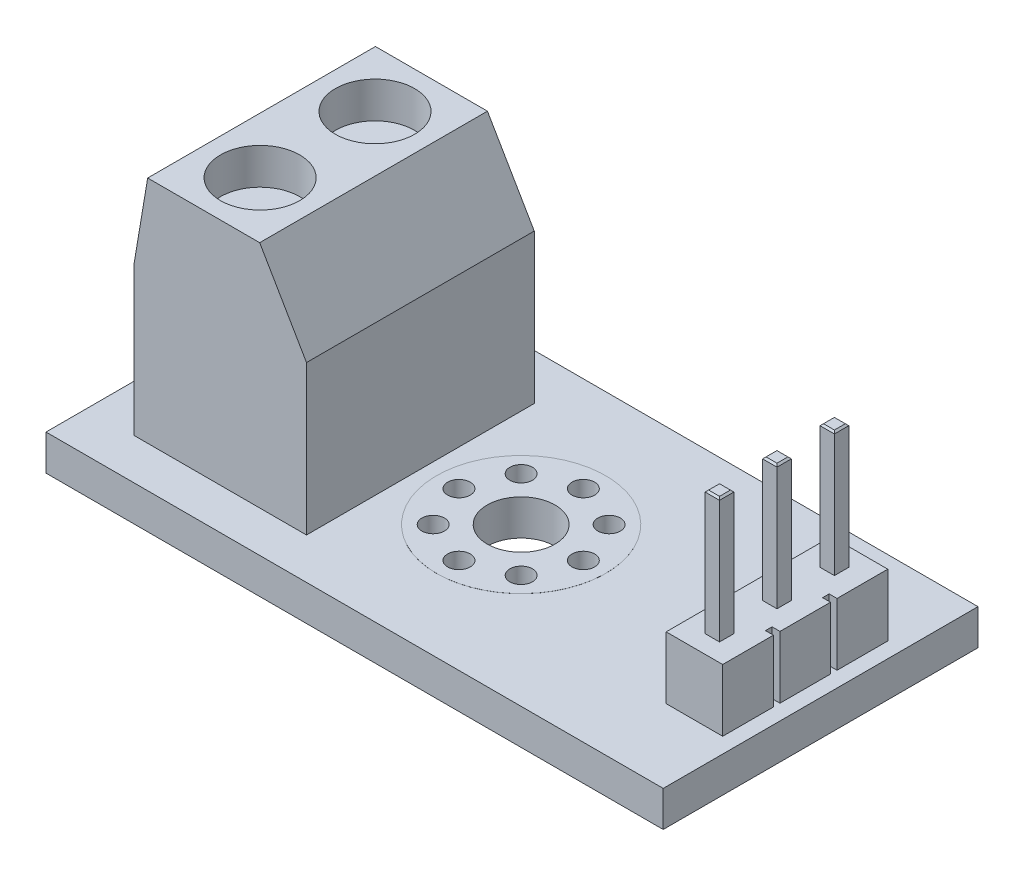
from build123d import *

# Parameters (mm, degrees)
SKETCH1_W                = 27.2923
SKETCH1_H                = 13.9192
BOSS_EXTRUDE1_DEPTH      = 0.7874
SKETCH2_R                = 1.5
SKETCH2_R_2              = 0.5
CUT_EXTRUDE1_DEPTH       = 16.399137542
SKETCH3_W                = 2.5
SKETCH3_H                = 7.3
BOSS_EXTRUDE2_DEPTH      = 2.75
SKETCH4_W                = 0.35
SKETCH4_H                = 0.29
CUT_EXTRUDE2_DEPTH       = 2.75
BOSS_EXTRUDE3_DEPTH      = 5.5
BOSS_EXTRUDE3_DEPTH_BACK = 5.7726
SKETCH5_W                = 0.635
SKETCH5_H                = 0.635
BOSS_EXTRUDE4_START      = 0.00254
SKETCH6_R                = 3.741578583
SKETCH6_R_2              = 0.5
SKETCH6_R_3              = 1.5
BOSS_EXTRUDE4_DEPTH      = 0.00254
SKETCH7_W                = 7.62
SKETCH7_H                = 10.0711
BOSS_EXTRUDE5_DEPTH      = 10.16
CUT_EXTRUDE3_DEPTH       = 19.82814406
CUT_EXTRUDE3_DEPTH_BACK  = 19.82814406
SKETCH9_R                = 1.7526
CUT_EXTRUDE4_DEPTH       = 1.6002
SKETCH10_W               = 0.635
SKETCH10_H               = 0.635
BOSS_EXTRUDE6_DEPTH      = 3.7338
CHAMFER1_SIZE            = 0.0762
SKETCH11_W               = 4.064
SKETCH11_H               = 5.08
CUT_EXTRUDE5_DEPTH       = 1.6002


with BuildPart() as part:
    # Sketch1 → Boss-Extrude1 (new, symmetric)
    with BuildSketch(Plane(origin=(0, 0, 0), x_dir=(1, 0, 0), z_dir=(0, 1, 0))):
        Rectangle(SKETCH1_W, SKETCH1_H)
    extrude(amount=BOSS_EXTRUDE1_DEPTH, both=True)

    # Sketch2 → Cut-Extrude1 (cut, through all)
    with BuildSketch(Plane(origin=(0, 0.7874, 0), x_dir=(1, 0, 0), z_dir=(0, 1, 0))):
        with Locations(Location((0.40385, 0, 0), (0, 0, 270))):
            Circle(SKETCH2_R)
        with Locations(Location((0.40385, 2.75, 0), (0, 0, 270))):
            Circle(SKETCH2_R_2)
        with Locations(Location((2.348393648, 1.944543648, 0), (0, 0, 270))):
            Circle(SKETCH2_R_2)
        with Locations(Location((3.15385, 0, 0), (0, 0, 270))):
            Circle(SKETCH2_R_2)
        with Locations(Location((2.348393648, -1.944543648, 0), (0, 0, 270))):
            Circle(SKETCH2_R_2)
        with Locations(Location((0.40385, -2.75, 0), (0, 0, 270))):
            Circle(SKETCH2_R_2)
        with Locations(Location((-1.540693648, -1.944543648, 0), (0, 0, 270))):
            Circle(SKETCH2_R_2)
        with Locations(Location((-2.34615, 0, 0), (0, 0, 270))):
            Circle(SKETCH2_R_2)
        with Locations(Location((-1.540693648, 1.944543648, 0), (0, 0, 270))):
            Circle(SKETCH2_R_2)
    extrude(amount=-CUT_EXTRUDE1_DEPTH, mode=Mode.SUBTRACT)

    # Sketch3 → Boss-Extrude2 (add)
    with BuildSketch(Plane(origin=(0, 0.7874, 0), x_dir=(1, 0, 0), z_dir=(0, 1, 0))):
        with Locations((11.71615, 0)):
            Rectangle(SKETCH3_W, SKETCH3_H)
    extrude(amount=BOSS_EXTRUDE2_DEPTH)

    # Sketch4 → Cut-Extrude2 (cut)
    with BuildSketch(Plane(origin=(0, 3.5374, 0), x_dir=(1, 0, 0), z_dir=(0, 1, 0))):
        with Locations((10.64115, 1.261418)):
            Rectangle(SKETCH4_W, SKETCH4_H)
        with Locations((10.64115, -1.261418)):
            Rectangle(SKETCH4_W, SKETCH4_H)
        with Locations((12.79115, -1.261418)):
            Rectangle(SKETCH4_W, SKETCH4_H)
        with Locations((12.79115, 1.261418)):
            Rectangle(SKETCH4_W, SKETCH4_H)
    extrude(amount=-CUT_EXTRUDE2_DEPTH, mode=Mode.SUBTRACT)

    # Sketch5 → Boss-Extrude3 (add, two sides: drawn at the far end of the back side and taken through both)
    with BuildSketch(Plane(origin=(0, 3.5374, 0), x_dir=(1, 0, 0), z_dir=(0, 1, 0)).offset(-BOSS_EXTRUDE3_DEPTH_BACK)):
        with Locations((11.71615, 0)):
            Rectangle(SKETCH5_W, SKETCH5_H)
        with Locations((11.71615, 2.54)):
            Rectangle(SKETCH5_W, SKETCH5_H)
        with Locations((11.71615, -2.54)):
            Rectangle(SKETCH5_W, SKETCH5_H)
    extrude(amount=BOSS_EXTRUDE3_DEPTH + BOSS_EXTRUDE3_DEPTH_BACK)

    # Sketch6 → Boss-Extrude4 (add)
    with BuildSketch(Plane(origin=(0, 0.7874, 0), x_dir=(1, 0, 0), z_dir=(0, 1, 0)).offset(BOSS_EXTRUDE4_START)):
        with Locations(Location((0.40385, 0, 0), (0, 0, 270))):
            Circle(SKETCH6_R)
        with Locations(Location((-2.34615, 0, 0), (0, 0, 270))):
            Circle(SKETCH6_R_2, mode=Mode.SUBTRACT)
        with Locations(Location((-1.540693648, -1.944543648, 0), (0, 0, 270))):
            Circle(SKETCH6_R_2, mode=Mode.SUBTRACT)
        with Locations(Location((0.40385, -2.75, 0), (0, 0, 270))):
            Circle(SKETCH6_R_2, mode=Mode.SUBTRACT)
        with Locations(Location((2.348393648, -1.944543648, 0), (0, 0, 270))):
            Circle(SKETCH6_R_2, mode=Mode.SUBTRACT)
        with Locations(Location((3.15385, 0, 0), (0, 0, 270))):
            Circle(SKETCH6_R_2, mode=Mode.SUBTRACT)
        with Locations(Location((2.348393648, 1.944543648, 0), (0, 0, 270))):
            Circle(SKETCH6_R_2, mode=Mode.SUBTRACT)
        with Locations(Location((0.40385, 0, 0), (0, 0, 270))):
            Circle(SKETCH6_R_3, mode=Mode.SUBTRACT)
        with Locations(Location((-1.540693648, 1.944543648, 0), (0, 0, 270))):
            Circle(SKETCH6_R_2, mode=Mode.SUBTRACT)
        with Locations(Location((0.40385, 2.75, 0), (0, 0, 270))):
            Circle(SKETCH6_R_2, mode=Mode.SUBTRACT)
    boss_extrude4 = extrude(amount=-BOSS_EXTRUDE4_DEPTH)

    # Mirror1: Boss-Extrude4 across plane
    add(boss_extrude4.mirror(Plane.ZX))

    # Sketch7 → Boss-Extrude5 (add)
    with BuildSketch(Plane(origin=(0, 0.7874, 0), x_dir=(1, 0, 0), z_dir=(0, 1, 0))):
        with Locations((-7.75335, -0.10795)):
            Rectangle(SKETCH7_W, SKETCH7_H)
    extrude(amount=BOSS_EXTRUDE5_DEPTH)

    # Sketch8 → Cut-Extrude3 (cut, two sides: drawn at the far end of the back side and taken through both)
    with BuildSketch(Plane.XY.offset(-CUT_EXTRUDE3_DEPTH_BACK)):
        Polygon((-6.01345, 10.9474), (-3.94335, 7.3914), (-3.94335, 10.9474), align=None)
        Polygon((-10.96645, 10.9474), (-11.56335, 10.9474), (-11.56335, 7.3914), align=None)
    extrude(amount=CUT_EXTRUDE3_DEPTH + CUT_EXTRUDE3_DEPTH_BACK, mode=Mode.SUBTRACT)

    # Sketch9 → Cut-Extrude4 (cut)
    with BuildSketch(Plane(origin=(0, 10.9474, 0), x_dir=(1, 0, 0), z_dir=(0, 1, 0))):
        with Locations(Location((-8.48995, 2.43205, 0), (0, 0, 270))):
            Circle(SKETCH9_R)
        with Locations(Location((-8.48995, -2.64795, 0), (0, 0, 270))):
            Circle(SKETCH9_R)
    extrude(amount=-CUT_EXTRUDE4_DEPTH, mode=Mode.SUBTRACT)

    # Sketch10 → Boss-Extrude6 (add)
    with BuildSketch(Plane(origin=(0, 0.7874, 0), x_dir=(1, 0, 0), z_dir=(0, 1, 0))):
        with Locations((-8.48995, 2.43205)):
            Rectangle(SKETCH10_W, SKETCH10_H)
        with Locations((-8.48995, -2.64795)):
            Rectangle(SKETCH10_W, SKETCH10_H)
    extrude(amount=-BOSS_EXTRUDE6_DEPTH)

    # Chamfer1
    chamfer1_edges = [part.edges().sort_by_distance(p)[0] for p in [
        (12.03365, -2.2352, 0),
        (11.71615, -2.2352, 0.3175),
        (11.39865, -2.2352, 0),
        (11.71615, -2.2352, -0.3175),
        (12.03365, 9.0374, 0),
        (11.71615, 9.0374, -0.3175),
        (11.39865, 9.0374, 0),
        (11.71615, 9.0374, 0.3175),
        (12.03365, -2.2352, -2.54),
        (11.71615, -2.2352, -2.2225),
        (11.39865, -2.2352, -2.54),
        (11.71615, -2.2352, -2.8575),
        (12.03365, 9.0374, -2.54),
        (11.71615, 9.0374, -2.8575),
        (11.39865, 9.0374, -2.54),
        (11.71615, 9.0374, -2.2225),
        (12.03365, -2.2352, 2.54),
        (11.71615, -2.2352, 2.8575),
        (11.39865, -2.2352, 2.54),
        (11.71615, -2.2352, 2.2225),
        (12.03365, 9.0374, 2.54),
        (11.71615, 9.0374, 2.2225),
        (11.39865, 9.0374, 2.54),
        (11.71615, 9.0374, 2.8575),
        (-8.17245, -2.9464, -2.43205),
        (-8.48995, -2.9464, -2.11455),
        (-8.80745, -2.9464, -2.43205),
        (-8.48995, -2.9464, -2.74955),
        (-8.17245, -2.9464, 2.64795),
        (-8.48995, -2.9464, 2.96545),
        (-8.80745, -2.9464, 2.64795),
        (-8.48995, -2.9464, 2.33045),
    ]]
    chamfer(chamfer1_edges, length=CHAMFER1_SIZE)

    # Sketch11 → Cut-Extrude5 (cut)
    with BuildSketch(Plane.ZY.offset(11.56335)):
        with Locations((-2.4638, 3.987287249)):
            Rectangle(SKETCH11_W, SKETCH11_H)
        with Locations((2.4638, 3.987287249)):
            Rectangle(SKETCH11_W, SKETCH11_H)
    extrude(amount=-CUT_EXTRUDE5_DEPTH, mode=Mode.SUBTRACT)


solid = part.part
